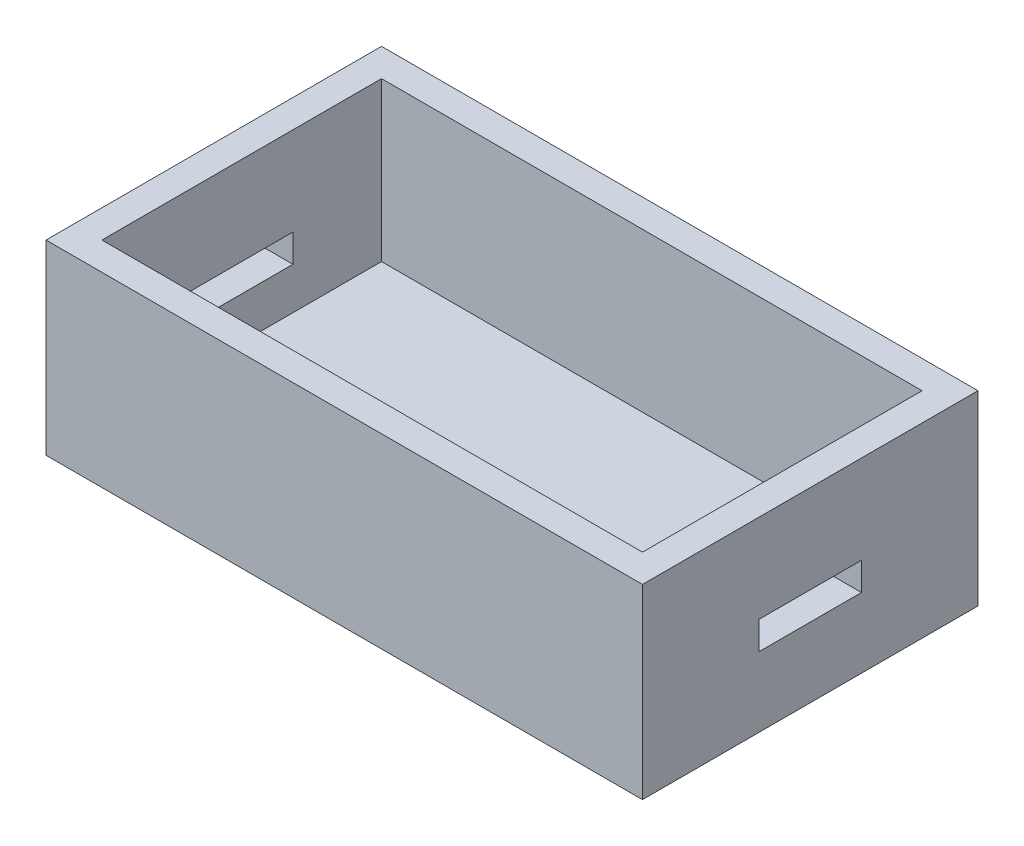
from build123d import *

# Parameters (mm, degrees)
SKETCH1_W           = 32
SKETCH1_H           = 18
BOSS_EXTRUDE1_DEPTH = 10
SHELL1_T            = -1.5
SKETCH3_W           = 5.5
SKETCH3_H           = 1.5
CUT_EXTRUDE1_DEPTH  = 35.713109915


with BuildPart() as part:
    # Sketch1 → Boss-Extrude1 (new body)
    with BuildSketch(Plane(origin=(0, 0, 0), x_dir=(1, 0, 0), z_dir=(0, 1, 0))):
        Rectangle(SKETCH1_W, SKETCH1_H)
    extrude(amount=BOSS_EXTRUDE1_DEPTH)

    # Shell1
    shell1_openings = [part.faces().sort_by_distance(p)[0] for p in [
        (0, 10, 0),
    ]]
    offset(amount=SHELL1_T, openings=shell1_openings, kind=Kind.INTERSECTION)

    # Sketch3 → Cut-Extrude1 (cut, through all)
    with BuildSketch(Plane(origin=(16, 0, 0), x_dir=(0, 0, -1), z_dir=(1, 0, 0))):
        with Locations((0, 4.5)):
            Rectangle(SKETCH3_W, SKETCH3_H)
    extrude(amount=-CUT_EXTRUDE1_DEPTH, mode=Mode.SUBTRACT)


solid = part.part
